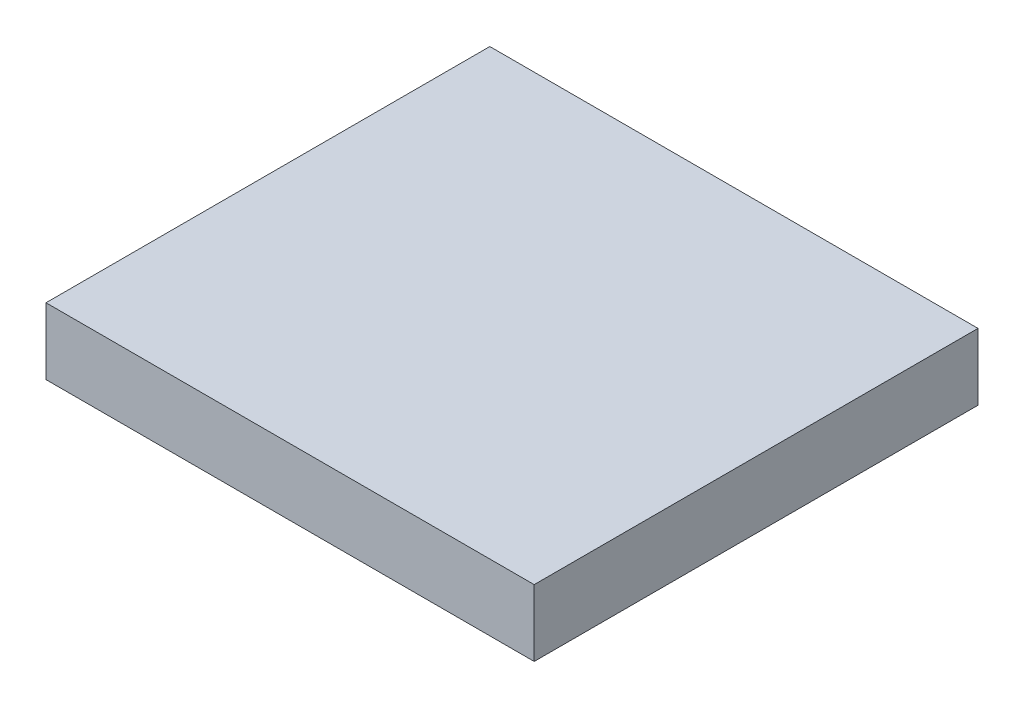
from build123d import *

# Parameters (mm, degrees)
SKETCH1_W           = 44
SKETCH1_H           = 40
BOSS_EXTRUDE1_DEPTH = 6


with BuildPart() as part:
    # Sketch1 → Boss-Extrude1 (new body)
    with BuildSketch(Plane(origin=(0, 0, 0), x_dir=(1, 0, 0), z_dir=(0, 1, 0))):
        with Locations((-57, 0)):
            Rectangle(SKETCH1_W, SKETCH1_H)
    extrude(amount=-BOSS_EXTRUDE1_DEPTH)


solid = part.part
